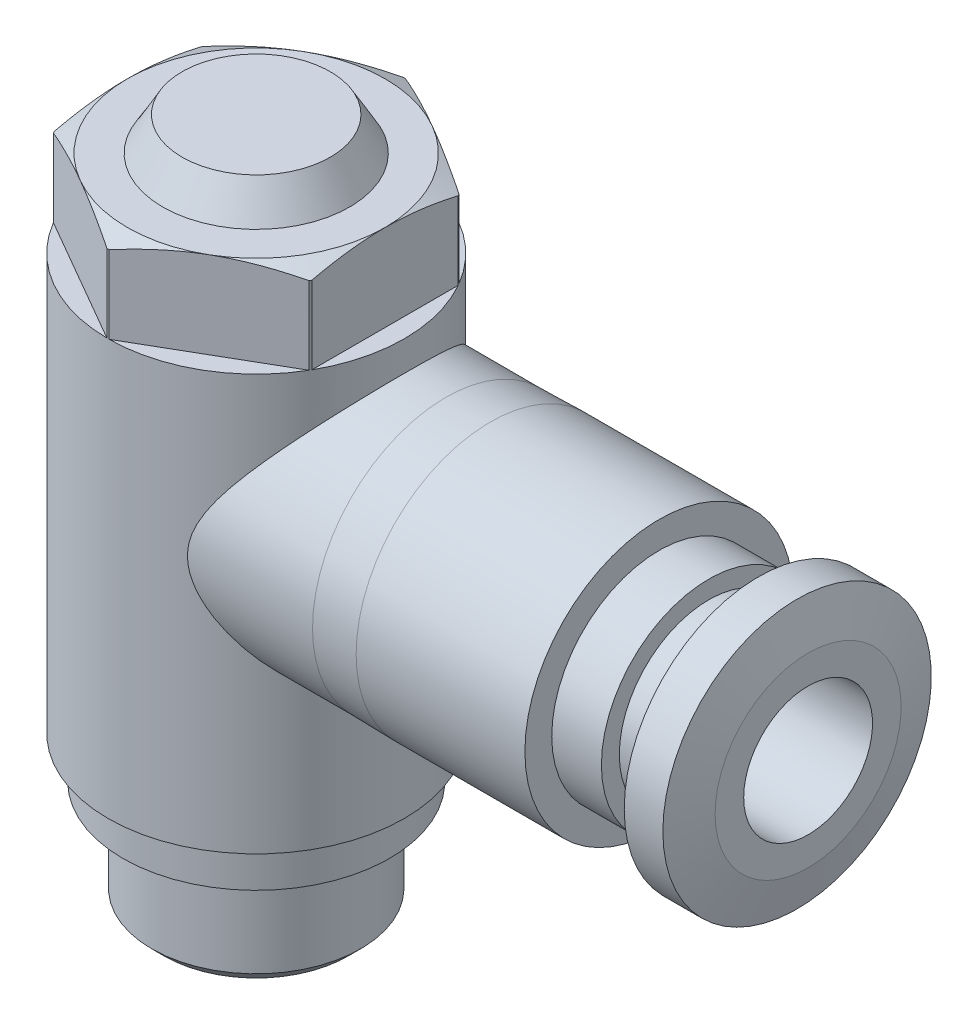
from build123d import *

# Parameters (mm, degrees)
LINEAR_AUSTRAGEN1_DEPTH      = 4.035
LINEAR_AUSTRAGEN1_DEPTH_BACK = 4.035


with BuildPart() as part:
    # Skizze1 → Rotation1 (revolve)
    with BuildSketch(Plane.XY, mode=Mode.PRIVATE) as rotation1_sk:
        Polygon((0, 13.2), (3.45, 13.2), (4.35078189, 11.6398), (6, 11.6398), (6.9, 11.220123108), (6.9, -11.742857143), (6.21, -11.742857143), (6.21, -13.7), (4.864, -13.7), (4.864, -18.019), (4.283, -18.6), (3.648, -18.6), (3.648, -8.872), (0, -8.872), align=None)
    revolve(rotation1_sk.sketch.rotate(Axis((0, -18.6, 0), (0, 1, 0)), 270), axis=Axis((0, -18.6, 0), (0, 1, 0)))

    # Skizze2 → Linear austragen1 (cut, two sides: drawn at the far end of the back side and taken through both)
    with BuildSketch(Plane(origin=(0, 11.6398, 0), x_dir=(-1, 0, 0), z_dir=(0, 1, 0)).offset(-LINEAR_AUSTRAGEN1_DEPTH_BACK)):
        Polygon((7.8, -4.5033321), (7.8, 4.5033321), (0, 9.006664199), (-7.8, 4.5033321), (-7.8, -4.5033321), (-0.05, -8.977796686), (-0.05, -6.899335717), (-6, -3.464101615), (-6, 3.464101615), (0, 6.92820323), (6, 3.464101615), (6, -3.464101615), (0, -6.92820323), (0, -9.006664199), align=None)
    extrude(amount=LINEAR_AUSTRAGEN1_DEPTH + LINEAR_AUSTRAGEN1_DEPTH_BACK, mode=Mode.SUBTRACT)

    # Skizze3 → Rotation2 (revolve)
    with BuildSketch(Plane.XY, mode=Mode.PRIVATE) as rotation2_sk:
        Polygon((0, 0), (0, 6.21), (8.832, 6.21), (10.902, 6.25), (18.761, 6.25), (18.761, 5), (21.074, 5), (21.074, 4.166666667), (23.387, 4.166666667), (23.387, 6.25), (25.186, 6.25), (25.7, 4.331725885), (25.7, 3), (7.7, 3), (7.7, 0), align=None)
    revolve(rotation2_sk.sketch.rotate(Axis((25.7, 0, 0), (-1, 0, 0)), 270), axis=Axis((25.7, 0, 0), (-1, 0, 0)))


solid = part.part
